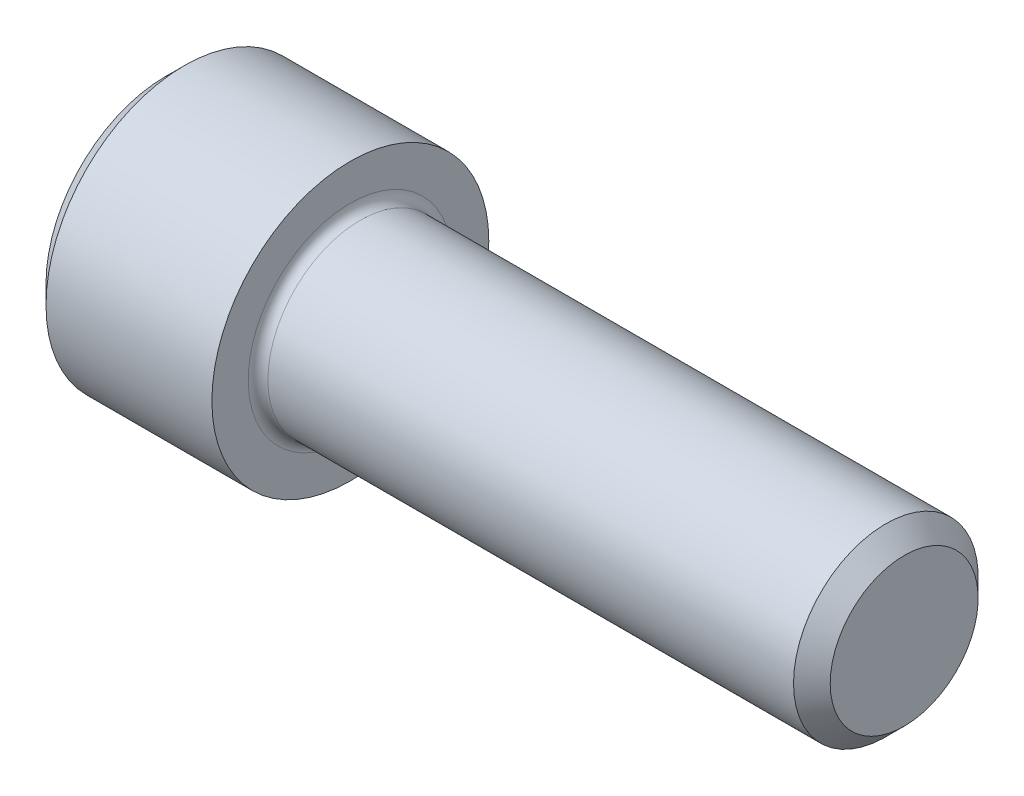
from build123d import *

# Parameters (mm, degrees)
FILLET1_R   = 0.508
HEX_2_DEPTH = 4.6228


with BuildPart() as part:
    # BodySke → Base-Revolve (revolve)
    with BuildSketch(Plane.XY, mode=Mode.PRIVATE) as base_revolve_sk:
        Polygon((0, 0), (0, 6.17855), (0.9652, 7.14375), (9.525, 7.14375), (9.525, 4.7625), (37.15385, 4.7625), (38.1, 3.81635), (38.1, 0), align=None)
    revolve(base_revolve_sk.sketch.rotate(Axis((-31.75, 0, 0), (1, 0, 0)), 90), axis=Axis((-31.75, 0, 0), (1, 0, 0)))

    # Fillet1
    fillet1_edges = [part.edges().sort_by_distance(p)[0] for p in [
        (9.525, 0, -4.7625),
    ]]
    fillet(fillet1_edges, radius=FILLET1_R)

    # Sketch2 → Hex-PreBroach (revolve, cut)
    with BuildSketch(Plane.XY, mode=Mode.PRIVATE) as hex_prebroach_sk:
        Polygon((0, 3.96875), (4.6228, 3.96875), (6.914158881, 0), (0, 0), align=None)
    revolve(hex_prebroach_sk.sketch.rotate(Axis((0, 0, 0), (1, 0, 0)), 90), axis=Axis((0, 0, 0), (1, 0, 0)), mode=Mode.SUBTRACT)

    # Sketch3 → Hex 2 (cut)
    with BuildSketch(Plane(origin=(0, 0, 0), x_dir=(0, 0.500000000000001, 0.866025403784438), z_dir=(-1, 0, 0))):
        Polygon((2.291358881, 3.96875), (-2.291358881, 3.96875), (-4.582717762, 0), (-2.291358881, -3.96875), (2.291358881, -3.96875), (4.582717762, 0), align=None)
    extrude(amount=-HEX_2_DEPTH, mode=Mode.SUBTRACT)


solid = part.part
